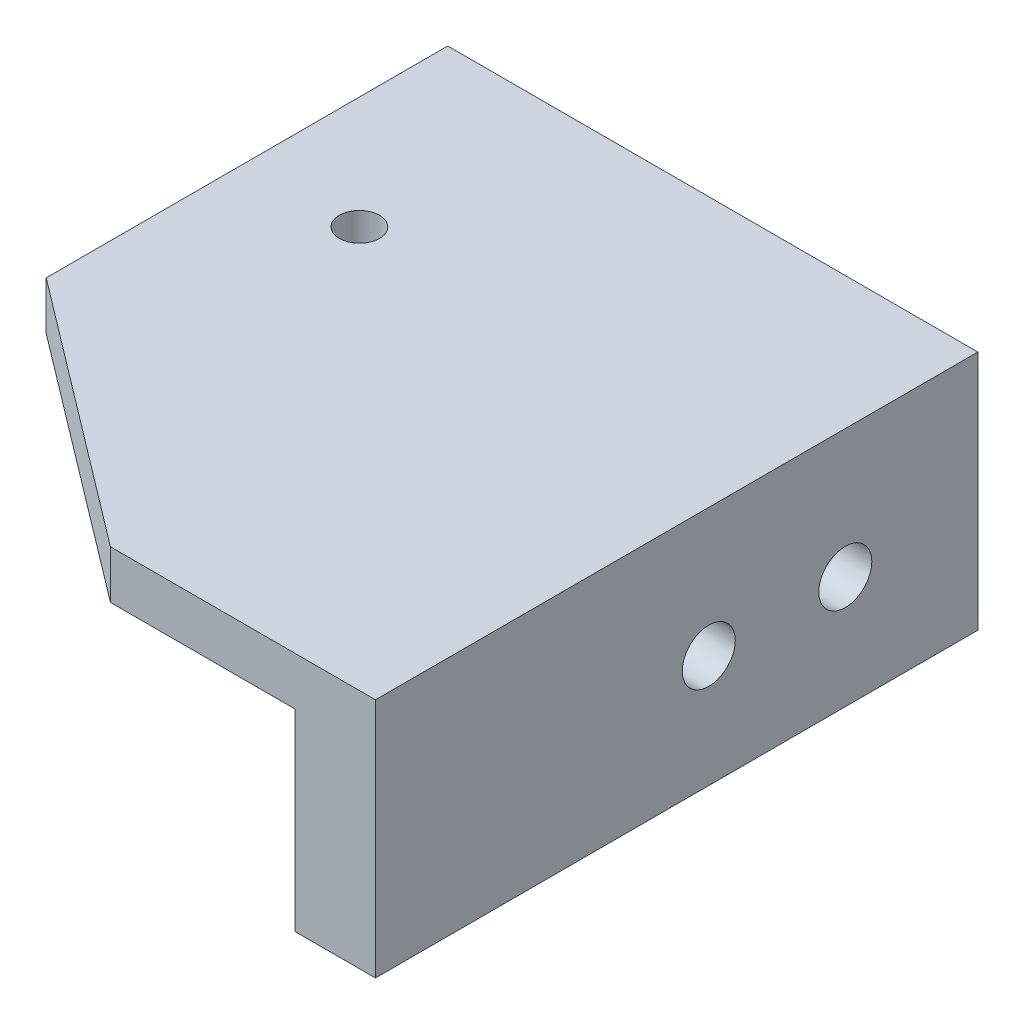
from build123d import *

# Parameters (mm, degrees)
AUFSATZ_LINEAR_AUSTRAGEN1_DEPTH      = 25
AUFSATZ_LINEAR_AUSTRAGEN1_DEPTH_BACK = 12.5
SKIZZE1_W                            = 33
SKIZZE1_H                            = 15
SKIZZE2_W                            = 28
SKIZZE2_H                            = 12
SCHNITT_LINEAR_AUSTRAGEN1_DEPTH      = 42.650330131
M3_GEWINDEBOHRUNG1_D                 = 2.5
M4_GEWINDEBOHRUNG1_D                 = 3.3
SCHNITT_LINEAR_AUSTRAGEN2_DEPTH      = 34.5


with BuildPart() as part:
    # Skizze1 → Aufsatz-Linear austragen1 (new, two sides: drawn at the far end of the back side and taken through both)
    with BuildSketch(Plane.XY.offset(-AUFSATZ_LINEAR_AUSTRAGEN1_DEPTH_BACK)):
        Rectangle(SKIZZE1_W, SKIZZE1_H)
    extrude(amount=AUFSATZ_LINEAR_AUSTRAGEN1_DEPTH + AUFSATZ_LINEAR_AUSTRAGEN1_DEPTH_BACK)

    # Skizze2 → Schnitt-Linear austragen1 (cut, through all)
    with BuildSketch(Plane.XY.offset(25)):
        with Locations((-2.5, -1.5)):
            Rectangle(SKIZZE2_W, SKIZZE2_H)
    extrude(amount=-SCHNITT_LINEAR_AUSTRAGEN1_DEPTH, mode=Mode.SUBTRACT)

    # M3 Gewindebohrung1 (through all)
    with Locations(Plane(origin=(0, 7.5, 0), x_dir=(1, 0, 0), z_dir=(0, 1, 0))):
        with Locations((-9.5, 0)):
            Hole(M3_GEWINDEBOHRUNG1_D / 2)

    # M4 Gewindebohrung1 (through all)
    with Locations(Plane(origin=(16.5, 0, 0), x_dir=(0, 0, -1), z_dir=(1, 0, 0))):
        with Locations((-4.25, -0.5), (4.25, -0.5)):
            Hole(M4_GEWINDEBOHRUNG1_D / 2)

    # Skizze7 → Schnitt-Linear austragen2 (cut, through all)
    with BuildSketch(Plane(origin=(0, 7.5, 0), x_dir=(1, 0, 0), z_dir=(0, 1, 0))):
        Polygon((0, -25), (-16.5, -12.5), (-16.5, -25), align=None)
    extrude(amount=-SCHNITT_LINEAR_AUSTRAGEN2_DEPTH, mode=Mode.SUBTRACT)


solid = part.part
